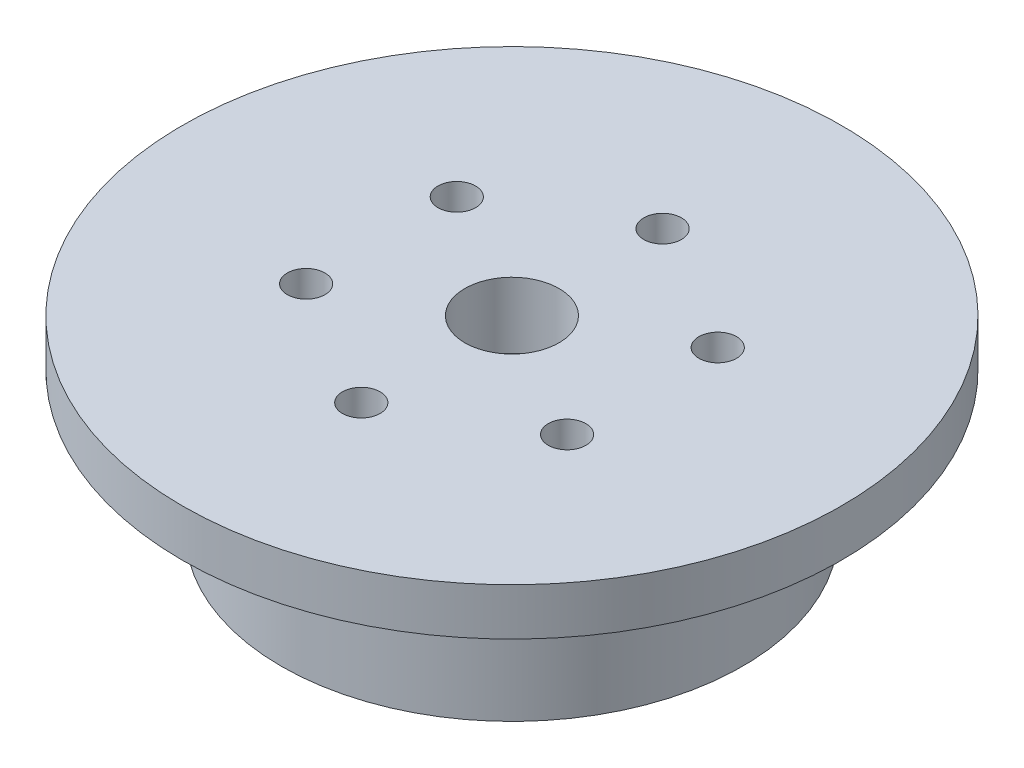
from build123d import *

# Parameters (mm, degrees)
CROQUIS1_R              = 35
SALIENTE_EXTRUIR1_DEPTH = 5
CROQUIS2_R              = 24.5
SALIENTE_EXTRUIR2_DEPTH = 15
CROQUIS3_R              = 6.85
SALIENTE_EXTRUIR3_DEPTH = 30
CROQUIS4_R              = 2
CORTAR_EXTRUIR1_DEPTH   = 10
MATRIZC1_COUNT          = 6
CORTAR_EXTRUIR2_START   = -30
CORTAR_EXTRUIR2_DEPTH   = 30
CUT_EXTRUDE1_START      = -40
CUT_EXTRUDE1_DEPTH      = 40
SKETCH2_R               = 5
CUT_EXTRUDE2_DEPTH      = 7
SKETCH3_R               = 3
CUT_EXTRUDE3_DEPTH      = 52.176166328


with BuildPart() as part:
    # Croquis1 → Saliente-Extruir1 (new body)
    with BuildSketch(Plane(origin=(0, 0, 0), x_dir=(1, 0, 0), z_dir=(0, 1, 0))):
        with Locations(Location((0, 0, 0), (0, 0, 270))):
            Circle(CROQUIS1_R)
    extrude(amount=SALIENTE_EXTRUIR1_DEPTH)

    # Croquis2 → Saliente-Extruir2 (add)
    with BuildSketch(Plane.XZ):
        with Locations(Location((0, 0, 0), (0, 0, 270))):
            Circle(CROQUIS2_R)
    extrude(amount=SALIENTE_EXTRUIR2_DEPTH)

    # Croquis3 → Saliente-Extruir3 (add)
    with BuildSketch(Plane.XZ.offset(15)):
        with Locations(Location((0, 0, 0), (0, 0, 270))):
            Circle(CROQUIS3_R)
    extrude(amount=SALIENTE_EXTRUIR3_DEPTH)

    # Croquis4 → Cortar-Extruir1 (cut)
    with BuildSketch(Plane(origin=(0, 5, 0), x_dir=(1, 0, 0), z_dir=(0, 1, 0))):
        with Locations(Location((0, 16, 0), (0, 0, 270))):
            Circle(CROQUIS4_R)
    cortar_extruir1 = extrude(amount=-CORTAR_EXTRUIR1_DEPTH, mode=Mode.SUBTRACT)

    # MatrizC1: Cortar-Extruir1 ×6 about axis
    matrizc1_axis = Axis((0, 0, 0), (0, 1, 0))
    for i in range(1, MATRIZC1_COUNT):
        add(cortar_extruir1.rotate(matrizc1_axis, i * 360 / MATRIZC1_COUNT), mode=Mode.SUBTRACT)

    # Croquis7 → Cortar-Extruir2 (cut)
    with BuildSketch(Plane.XZ.offset(45).offset(CORTAR_EXTRUIR2_START)):
        with BuildLine():
            Line((-6.37749951, 2.5), (-3.47749951, 2.5))
            Line((-3.47749951, 2.5), (-3.47749951, -2.5))
            Line((-3.47749951, -2.5), (-6.37749951, -2.5))
            ThreePointArc((-6.37749951, -2.5), (-6.85, 0), (-6.37749951, 2.5))
        make_face()
    extrude(amount=CORTAR_EXTRUIR2_DEPTH, mode=Mode.SUBTRACT)

    # Sketch1 → Cut-Extrude1 (cut)
    with BuildSketch(Plane.XZ.offset(45).offset(CUT_EXTRUDE1_START)):
        with BuildLine():
            Line((-6.37749951, -2.5), (-9.35, -2.5))
            Line((-9.35, -2.5), (-9.35, 2.5))
            Line((-9.35, 2.5), (-6.37749951, 2.5))
            ThreePointArc((-6.37749951, 2.5), (6.85, 0), (-6.37749951, -2.5))
        make_face()
    extrude(amount=CUT_EXTRUDE1_DEPTH, mode=Mode.SUBTRACT)

    # Sketch2 → Cut-Extrude2 (cut)
    with BuildSketch(Plane(origin=(0, 5, 0), x_dir=(1, 0, 0), z_dir=(0, 1, 0))):
        with Locations(Location((0, 0, 0), (0, 0, 270))):
            Circle(SKETCH2_R)
    extrude(amount=-CUT_EXTRUDE2_DEPTH, mode=Mode.SUBTRACT)

    # Sketch3 → Cut-Extrude3 (cut, through all)
    with BuildSketch(Plane(origin=(0, -2, 0), x_dir=(1, 0, 0), z_dir=(0, 1, 0))):
        with Locations(Location((0, 0, 0), (0, 0, 270))):
            Circle(SKETCH3_R)
    extrude(amount=-CUT_EXTRUDE3_DEPTH, mode=Mode.SUBTRACT)


solid = part.part
